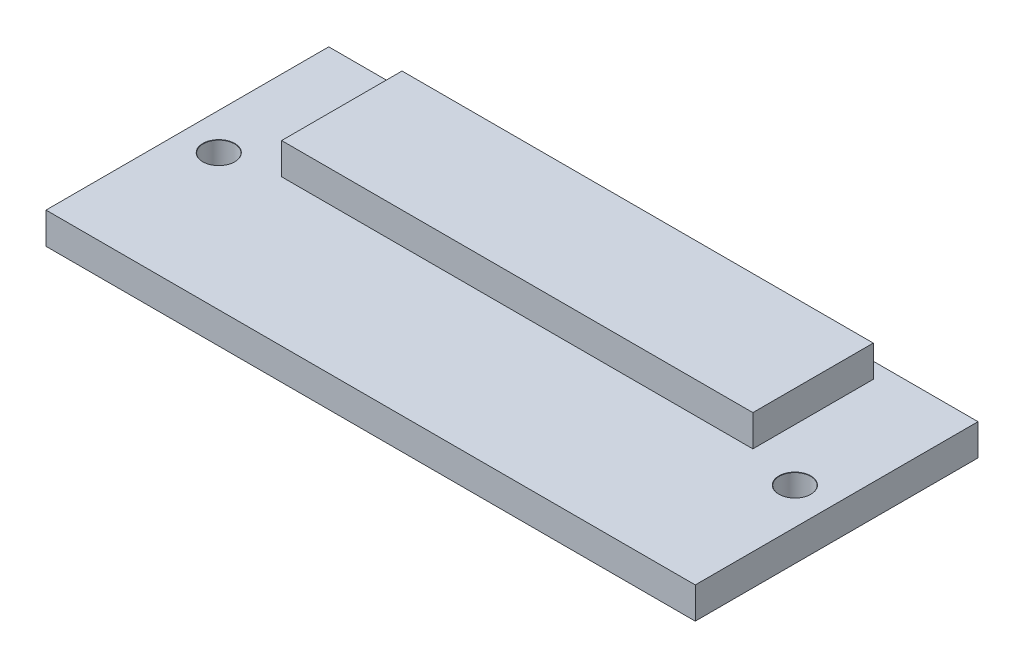
from build123d import *

# Parameters (mm, degrees)
SKETCH1_W                       = 62
SKETCH1_H                       = 27
BOSS_EXTRUDE1_DEPTH             = 3
F_3_0MM_DOWEL_HOLE1_D           = 3
F_3_0MM_DOWEL_HOLE1_CSINK_D     = 3.05
F_3_0MM_DOWEL_HOLE1_CSINK_ANGLE = 90
SKETCH5_W                       = 45
SKETCH5_H                       = 11.5
CUT_EXTRUDE1_DEPTH              = 68.690472003
SKETCH6_W                       = 45
SKETCH6_H                       = 11.5
BOSS_EXTRUDE2_DEPTH             = 3


with BuildPart() as part:
    # Sketch1 → Boss-Extrude1 (new body)
    with BuildSketch(Plane(origin=(0, 0, 0), x_dir=(1, 0, 0), z_dir=(0, 1, 0))):
        with Locations((31, 13.5)):
            Rectangle(SKETCH1_W, SKETCH1_H)
    extrude(amount=BOSS_EXTRUDE1_DEPTH)

    # Ø3.0mm Dowel Hole1 (through all)
    with Locations(Plane(origin=(0, 3, 0), x_dir=(1, 0, 0), z_dir=(0, 1, 0))):
        with Locations((3.5, 13), (58.499998178, 13.014156566)):
            CounterSinkHole(F_3_0MM_DOWEL_HOLE1_D / 2, F_3_0MM_DOWEL_HOLE1_CSINK_D / 2, counter_sink_angle=F_3_0MM_DOWEL_HOLE1_CSINK_ANGLE)

    # Sketch5 → Cut-Extrude1 (cut, through all)
    with BuildSketch(Plane(origin=(0, 3, 0), x_dir=(1, 0, 0), z_dir=(0, 1, 0))):
        with Locations((31, 19.75)):
            Rectangle(SKETCH5_W, SKETCH5_H)
    extrude(amount=-CUT_EXTRUDE1_DEPTH, mode=Mode.SUBTRACT)


with BuildPart() as body_2:
    # Sketch6 → Boss-Extrude2 (new body)
    with BuildSketch(Plane(origin=(0, 3, 0), x_dir=(1, 0, 0), z_dir=(0, 1, 0))):
        with Locations((31, 19.75)):
            Rectangle(SKETCH6_W, SKETCH6_H)
    extrude(amount=BOSS_EXTRUDE2_DEPTH)


solid = Compound([part.part, body_2.part])
